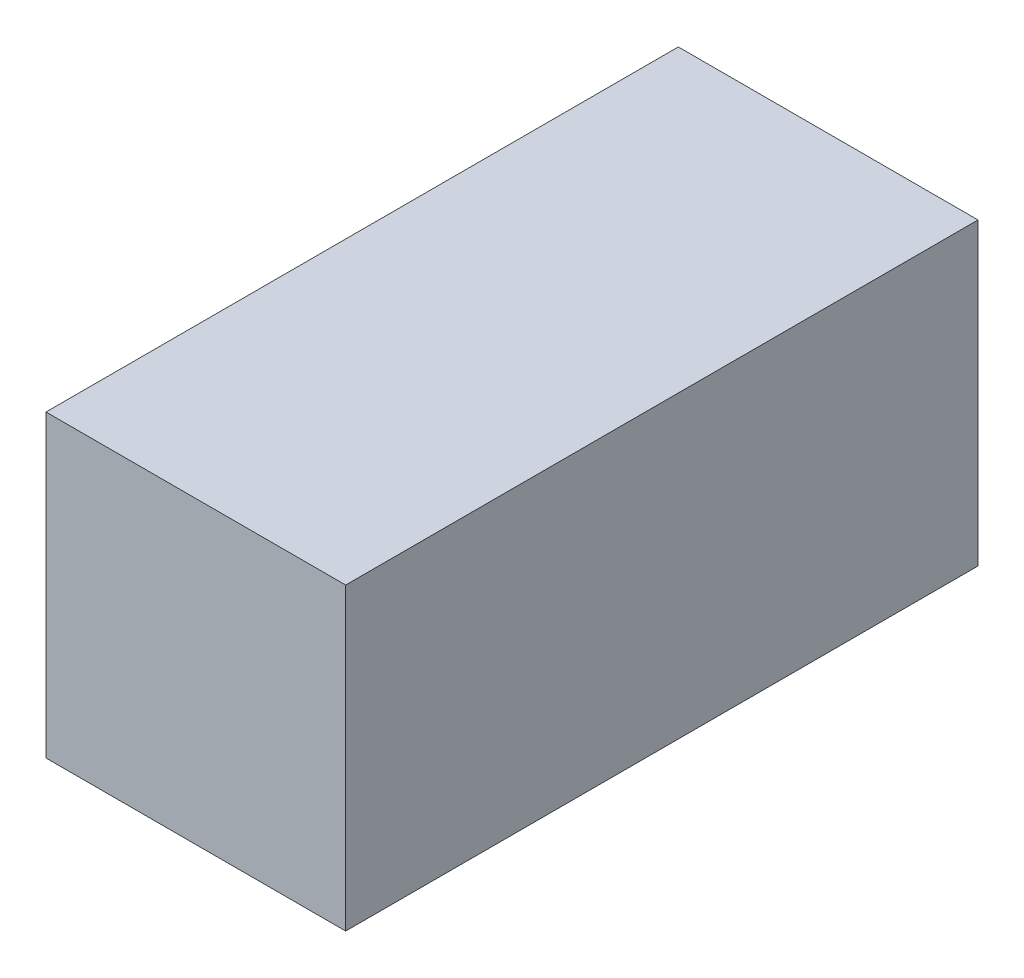
from build123d import *

# Parameters (mm, degrees)
SKETCH1_W           = 25.4
SKETCH1_H           = 25.4
BOSS_EXTRUDE1_DEPTH = 53.594


with BuildPart() as part:
    # Sketch1 → Boss-Extrude1 (new body)
    with BuildSketch(Plane.XY):
        with Locations((-26.022001152, 18.786688726)):
            Rectangle(SKETCH1_W, SKETCH1_H)
    extrude(amount=BOSS_EXTRUDE1_DEPTH)


solid = part.part
